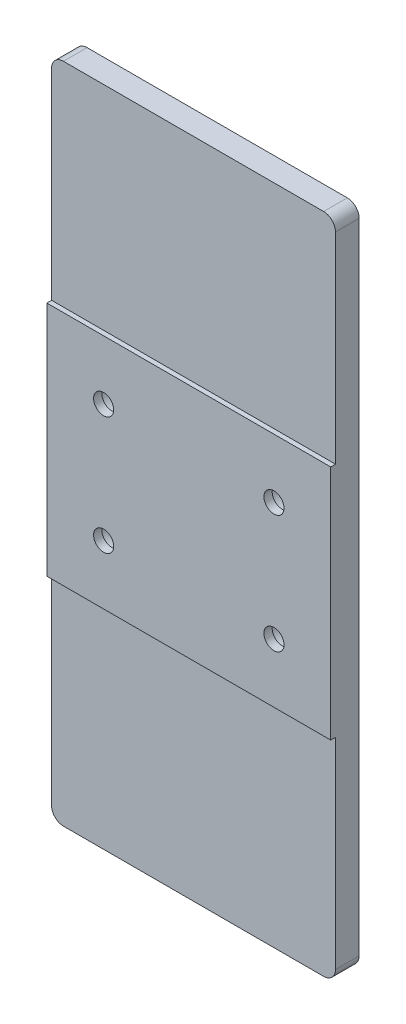
from build123d import *

# Parameters (mm, degrees)
SKETCH_1_W          = 120
SKETCH_1_H          = 280
SKETCH_1_R          = 4.25
EXTRUDE_1_DEPTH     = 10
FILLET_1_R          = 5
SKETCH_2_W          = 120
SKETCH_2_H          = 100
EXTRUDE_2_DEPTH     = 2
SKETCH_3_R          = 4.25
CUT_EXTRUDE_1_DEPTH = 35
SKETCH_5_R          = 7
CUT_EXTRUDE_3_DEPTH = 8.5


with BuildPart() as part:
    # 草图1 → 凸台-拉伸1 (new body)
    with BuildSketch(Plane.XY):
        Rectangle(SKETCH_1_W, SKETCH_1_H)
        with Locations((36, 25)):
            Circle(SKETCH_1_R, mode=Mode.SUBTRACT)
        with Locations(Location((36, -25, 0), (0, 0, 180))):
            Circle(SKETCH_1_R, mode=Mode.SUBTRACT)
        with Locations((-36, -25)):
            Circle(SKETCH_1_R, mode=Mode.SUBTRACT)
        with Locations(Location((-36, 25, 0), (0, 0, 180))):
            Circle(SKETCH_1_R, mode=Mode.SUBTRACT)
    extrude(amount=EXTRUDE_1_DEPTH)

    # 圆角1
    fillet_1_edges = [part.edges().sort_by_distance(p)[0] for p in [
        (-60, 140, 5),
        (60, 140, 5),
        (60, -140, 5),
        (-60, -140, 5),
    ]]
    fillet(fillet_1_edges, radius=FILLET_1_R)

    # 草图2 → 凸台-拉伸2 (add)
    with BuildSketch(Plane.XY.offset(10)):
        Rectangle(SKETCH_2_W, SKETCH_2_H)
    extrude(amount=EXTRUDE_2_DEPTH)

    # 草图3 → 切除-拉伸1 (cut)
    with BuildSketch(Plane(origin=(0, 0, 0), x_dir=(-1, 0, 0), z_dir=(0, 0, -1))):
        with Locations((-36, -25)):
            Circle(SKETCH_3_R)
        with Locations((-36, 25)):
            Circle(SKETCH_3_R)
        with Locations((36, 25)):
            Circle(SKETCH_3_R)
        with Locations((36, -25)):
            Circle(SKETCH_3_R)
    extrude(amount=-CUT_EXTRUDE_1_DEPTH, mode=Mode.SUBTRACT)

    # 草图5 → 切除-拉伸3 (cut)
    with BuildSketch(Plane(origin=(0, 0, 0), x_dir=(-1, 0, 0), z_dir=(0, 0, -1))):
        with Locations((36, 25)):
            Circle(SKETCH_5_R)
        with Locations((36, -25)):
            Circle(SKETCH_5_R)
        with Locations((-36, -25)):
            Circle(SKETCH_5_R)
        with Locations((-36, 25)):
            Circle(SKETCH_5_R)
    extrude(amount=-CUT_EXTRUDE_3_DEPTH, mode=Mode.SUBTRACT)


solid = part.part
